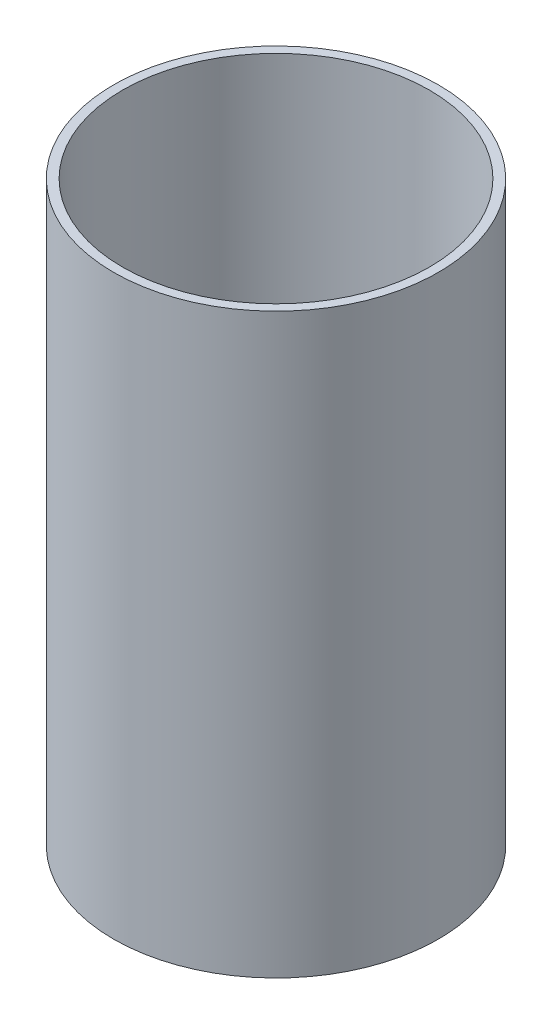
from build123d import *

# Parameters (mm, degrees)
SKETCH1_R           = 28.575
SKETCH1_R_2         = 26.9875
BOSS_EXTRUDE1_DEPTH = 101.6


with BuildPart() as part:
    # Sketch1 → Boss-Extrude1 (new body)
    with BuildSketch(Plane(origin=(0, 0, 0), x_dir=(1, 0, 0), z_dir=(0, 1, 0))):
        with Locations(Location((0, 0, 0), (0, 0, 270))):
            Circle(SKETCH1_R)
        with Locations(Location((0, 0, 0), (0, 0, 270))):
            Circle(SKETCH1_R_2, mode=Mode.SUBTRACT)
    extrude(amount=BOSS_EXTRUDE1_DEPTH)


solid = part.part
